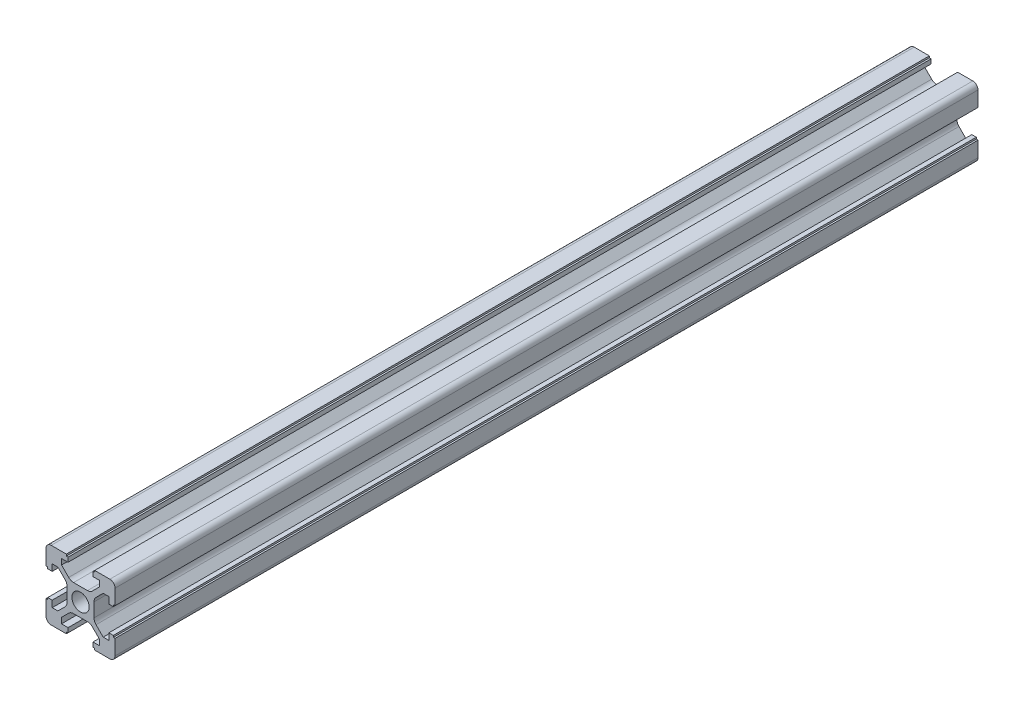
from build123d import *

# Parameters (mm, degrees)
SKETCH1_R           = 2.5
BOSS_EXTRUDE2_DEPTH = 250


with BuildPart() as part:
    # Sketch1 → Boss-Extrude2 (new body)
    with BuildSketch(Plane.XY):
        with BuildLine():
            Line((10, -4.1), (10, -8.5))
            ThreePointArc((10, -8.5), (9.560660172, -9.560660172), (8.5, -10))
            Line((8.5, -10), (4.1, -10))
            Line((4.1, -10), (4.1, -9.5))
            Line((4.1, -9.5), (3.6, -9.5))
            Line((3.6, -9.5), (3.6, -8.2))
            Line((3.6, -8.2), (5.5, -8.2))
            Line((5.5, -8.2), (5.5, -6.560660172))
            Line((5.5, -6.560660172), (3.425126266, -4.485786438))
            ThreePointArc((3.425126266, -4.485786438), (2.776279568, -4.052240935), (2.010912703, -3.9))
            Line((2.010912703, -3.9), (-2.010912703, -3.9))
            ThreePointArc((-2.010912703, -3.9), (-2.776279568, -4.052240935), (-3.425126266, -4.485786438))
            Line((-3.425126266, -4.485786438), (-5.5, -6.560660172))
            Line((-5.5, -6.560660172), (-5.5, -8.2))
            Line((-5.5, -8.2), (-3.6, -8.2))
            Line((-3.6, -8.2), (-3.6, -9.5))
            Line((-3.6, -9.5), (-4.1, -9.5))
            Line((-4.1, -9.5), (-4.1, -10))
            Line((-4.1, -10), (-8.5, -10))
            ThreePointArc((-8.5, -10), (-9.560660172, -9.560660172), (-10, -8.5))
            Line((-10, -8.5), (-10, -4.1))
            Line((-10, -4.1), (-9.5, -4.1))
            Line((-9.5, -4.1), (-9.5, -3.6))
            Line((-9.5, -3.6), (-8.2, -3.6))
            Line((-8.2, -3.6), (-8.2, -5.5))
            Line((-8.2, -5.5), (-6.560660172, -5.5))
            Line((-6.560660172, -5.5), (-4.485786438, -3.425126266))
            ThreePointArc((-4.485786438, -3.425126266), (-4.052240935, -2.776279568), (-3.9, -2.010912703))
            Line((-3.9, -2.010912703), (-3.9, 2.010912703))
            ThreePointArc((-3.9, 2.010912703), (-4.052240935, 2.776279568), (-4.485786438, 3.425126266))
            Line((-4.485786438, 3.425126266), (-6.560660172, 5.5))
            Line((-6.560660172, 5.5), (-8.2, 5.5))
            Line((-8.2, 5.5), (-8.2, 3.6))
            Line((-8.2, 3.6), (-9.5, 3.6))
            Line((-9.5, 3.6), (-9.5, 4.1))
            Line((-9.5, 4.1), (-10, 4.1))
            Line((-10, 4.1), (-10, 8.5))
            ThreePointArc((-10, 8.5), (-9.560660172, 9.560660172), (-8.5, 10))
            Line((-8.5, 10), (-4.1, 10))
            Line((-4.1, 10), (-4.1, 9.5))
            Line((-4.1, 9.5), (-3.6, 9.5))
            Line((-3.6, 9.5), (-3.6, 8.2))
            Line((-3.6, 8.2), (-5.5, 8.2))
            Line((-5.5, 8.2), (-5.5, 6.560660172))
            Line((-5.5, 6.560660172), (-3.425126266, 4.485786438))
            ThreePointArc((-3.425126266, 4.485786438), (-2.776279568, 4.052240935), (-2.010912703, 3.9))
            Line((-2.010912703, 3.9), (2.010912703, 3.9))
            ThreePointArc((2.010912703, 3.9), (2.776279568, 4.052240935), (3.425126266, 4.485786438))
            Line((3.425126266, 4.485786438), (5.5, 6.560660172))
            Line((5.5, 6.560660172), (5.5, 8.2))
            Line((5.5, 8.2), (3.6, 8.2))
            Line((3.6, 8.2), (3.6, 9.5))
            Line((3.6, 9.5), (4.1, 9.5))
            Line((4.1, 9.5), (4.1, 10))
            Line((4.1, 10), (8.5, 10))
            ThreePointArc((8.5, 10), (9.560660172, 9.560660172), (10, 8.5))
            Line((10, 8.5), (10, 4.1))
            Line((10, 4.1), (9.5, 4.1))
            Line((9.5, 4.1), (9.5, 3.6))
            Line((9.5, 3.6), (8.2, 3.6))
            Line((8.2, 3.6), (8.2, 5.5))
            Line((8.2, 5.5), (6.560660172, 5.5))
            Line((6.560660172, 5.5), (4.485786438, 3.425126266))
            ThreePointArc((4.485786438, 3.425126266), (4.052240935, 2.776279568), (3.9, 2.010912703))
            Line((3.9, 2.010912703), (3.9, -2.010912703))
            ThreePointArc((3.9, -2.010912703), (4.052240935, -2.776279568), (4.485786438, -3.425126266))
            Line((4.485786438, -3.425126266), (6.560660172, -5.5))
            Line((6.560660172, -5.5), (8.2, -5.5))
            Line((8.2, -5.5), (8.2, -3.6))
            Line((8.2, -3.6), (9.5, -3.6))
            Line((9.5, -3.6), (9.5, -4.1))
            Line((9.5, -4.1), (10, -4.1))
        make_face()
        Circle(SKETCH1_R, mode=Mode.SUBTRACT)
    extrude(amount=BOSS_EXTRUDE2_DEPTH)


solid = part.part
